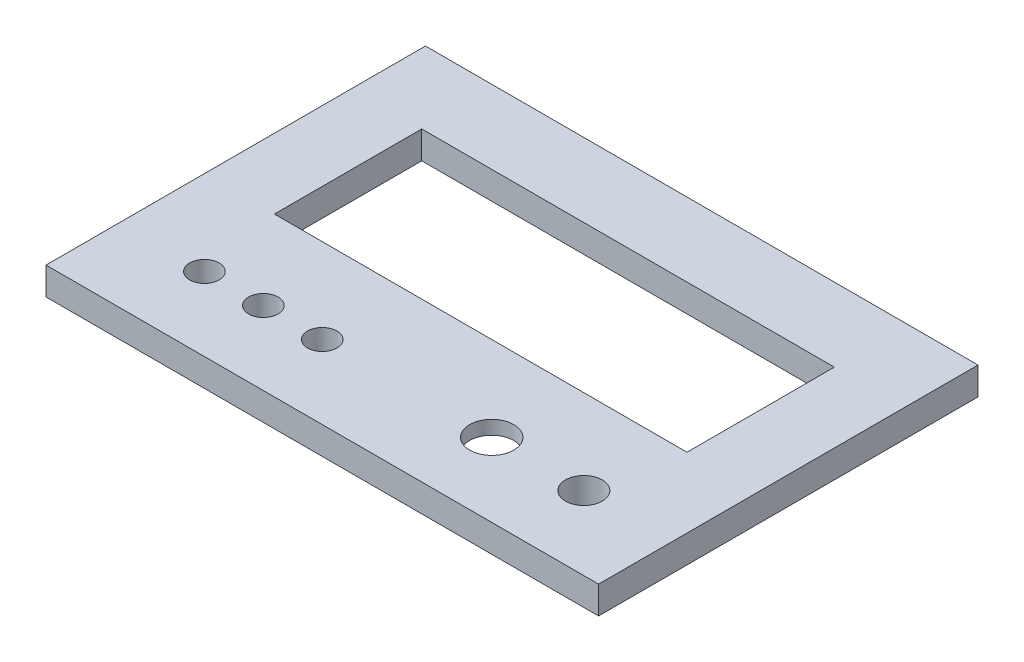
from build123d import *

# Parameters (mm, degrees)
SKETCH1_W               = 95.25
SKETCH1_H               = 65.405
SKETCH1_R               = 2.54
SKETCH1_R_2             = 3.175
SKETCH1_R_3             = 3.81
SKETCH1_W_2             = 71.12
SKETCH1_H_2             = 25.4
BOSS_EXTRUDE1_DEPTH     = 4.7625
SKETCH3_W               = 88.9
SKETCH3_H               = 59.055
SKETCH3_W_2             = 83.82
SKETCH3_H_2             = 53.975
BOSS_EXTRUDE2_DEPTH     = 2.54
CUT_EXTRUDE1_DEPTH      = 116.641938462
CUT_EXTRUDE1_DEPTH_BACK = 2.38125
SKETCH2_W               = 13.97
SKETCH2_H               = 13.97


with BuildPart() as part:
    # Sketch1 → Boss-Extrude1 (new body)
    with BuildSketch(Plane(origin=(0, 0, 0), x_dir=(1, 0, 0), z_dir=(0, 1, 0))):
        with Locations((47.625, 32.7025)):
            Rectangle(SKETCH1_W, SKETCH1_H)
        with Locations(Location((34.925, 12.7, 0), (0, 0, 90))):
            Circle(SKETCH1_R, mode=Mode.SUBTRACT)
        with Locations(Location((14.605, 12.7, 0), (0, 0, 90))):
            Circle(SKETCH1_R, mode=Mode.SUBTRACT)
        with Locations(Location((24.765, 12.7, 0), (0, 0, 90))):
            Circle(SKETCH1_R, mode=Mode.SUBTRACT)
        with Locations(Location((80.01, 12.7, 0), (0, 0, 90))):
            Circle(SKETCH1_R_2, mode=Mode.SUBTRACT)
        with Locations(Location((64.135, 12.7, 0), (0, 0, 90))):
            Circle(SKETCH1_R_3, mode=Mode.SUBTRACT)
        with Locations((47.625, 40.005)):
            Rectangle(SKETCH1_W_2, SKETCH1_H_2, mode=Mode.SUBTRACT)
    extrude(amount=BOSS_EXTRUDE1_DEPTH)

    # Sketch3 → Boss-Extrude2 (add)
    with BuildSketch(Plane.XZ):
        with Locations((47.625, -32.7025)):
            Rectangle(SKETCH3_W, SKETCH3_H)
        with Locations((47.625, -32.7025)):
            Rectangle(SKETCH3_W_2, SKETCH3_H_2, mode=Mode.SUBTRACT)
    extrude(amount=BOSS_EXTRUDE2_DEPTH)

    # Sketch2 → Cut-Extrude1 (cut, two sides: drawn at the far end of the back side and taken through both)
    with BuildSketch(Plane.XZ.offset(-CUT_EXTRUDE1_DEPTH_BACK)):
        with Locations((64.135, -12.7)):
            Rectangle(SKETCH2_W, SKETCH2_H)
    extrude(amount=CUT_EXTRUDE1_DEPTH + CUT_EXTRUDE1_DEPTH_BACK, mode=Mode.SUBTRACT)


solid = part.part
